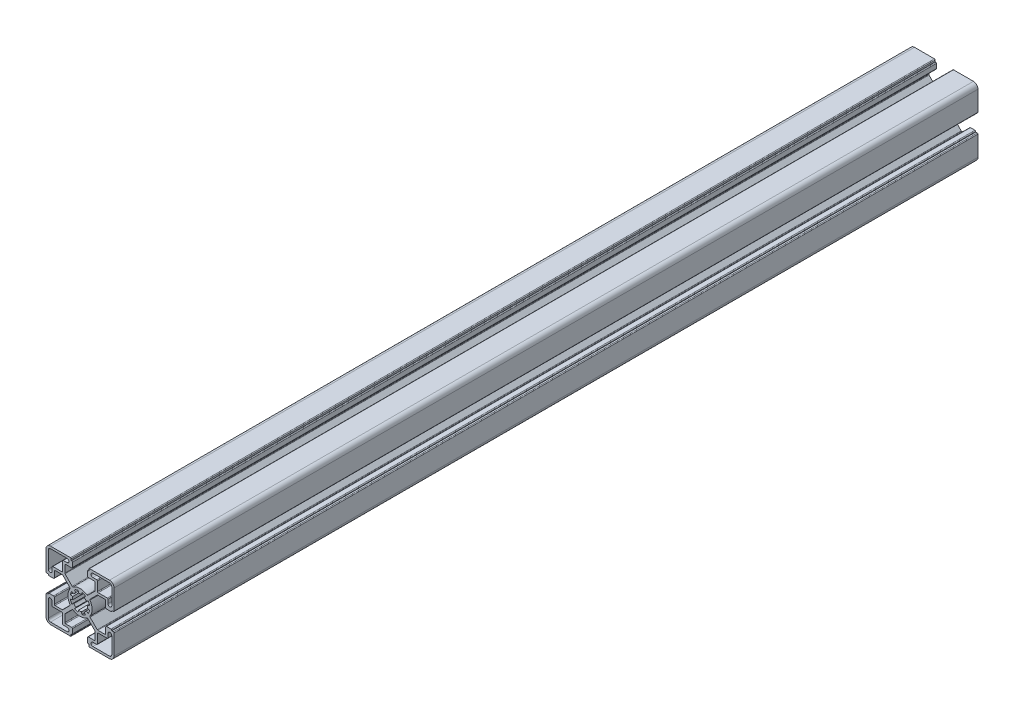
from build123d import *

# Parameters (mm, degrees)
BOSS_EXTRUDE1_DEPTH      = 152.4
BOSS_EXTRUDE1_DEPTH_BACK = 152.4
SKETCH3_R                = 5
FILLET1_R                = 0.5
CUT_EXTRUDE1_DEPTH       = 307.456424309
BOSS_EXTRUDE2_DEPTH      = 266.775


with BuildPart() as part:
    # Sketch3 → Boss-Extrude1 (new, two sides: drawn at the far end of the back side and taken through both)
    with BuildSketch(Plane.XY.offset(-BOSS_EXTRUDE1_DEPTH_BACK)):
        with BuildLine():
            Line((-11.55, -10.05), (-6.356915373, -4.856915373))
            ThreePointArc((-6.356915373, -4.856915373), (-8, 0), (-6.356915373, 4.856915373))
            Line((-6.356915373, 4.856915373), (-11.55, 10.05))
            Line((-11.55, 10.05), (-17.025, 10.05))
            Line((-17.025, 10.05), (-17.025, 5))
            Line((-17.025, 5), (-21, 5))
            Line((-21, 5), (-21, 5.8))
            Line((-21, 5.8), (-22.5, 5.8))
            Line((-22.5, 5.8), (-22.5, 19.5))
            ThreePointArc((-22.5, 19.5), (-21.621320344, 21.621320344), (-19.5, 22.5))
            Line((-19.5, 22.5), (-5.8, 22.5))
            Line((-5.8, 22.5), (-5.8, 21))
            Line((-5.8, 21), (-5, 21))
            Line((-5, 21), (-5, 17.025))
            Line((-5, 17.025), (-10.05, 17.025))
            Line((-10.05, 17.025), (-10.05, 11.55))
            Line((-10.05, 11.55), (-4.856915373, 6.356915373))
            ThreePointArc((-4.856915373, 6.356915373), (0, 8), (4.856915373, 6.356915373))
            Line((4.856915373, 6.356915373), (10.05, 11.55))
            Line((10.05, 11.55), (10.05, 17.025))
            Line((10.05, 17.025), (5, 17.025))
            Line((5, 17.025), (5, 21))
            Line((5, 21), (5.8, 21))
            Line((5.8, 21), (5.8, 22.5))
            Line((5.8, 22.5), (19.5, 22.5))
            ThreePointArc((19.5, 22.5), (21.621320344, 21.621320344), (22.5, 19.5))
            Line((22.5, 19.5), (22.5, 5.8))
            Line((22.5, 5.8), (21, 5.8))
            Line((21, 5.8), (21, 5))
            Line((21, 5), (17.025, 5))
            Line((17.025, 5), (17.025, 10.05))
            Line((17.025, 10.05), (11.55, 10.05))
            Line((11.55, 10.05), (6.356915373, 4.856915373))
            ThreePointArc((6.356915373, 4.856915373), (8, 0), (6.356915373, -4.856915373))
            Line((6.356915373, -4.856915373), (11.55, -10.05))
            Line((11.55, -10.05), (17.025, -10.05))
            Line((17.025, -10.05), (17.025, -5))
            Line((17.025, -5), (21, -5))
            Line((21, -5), (21, -5.8))
            Line((21, -5.8), (22.5, -5.8))
            Line((22.5, -5.8), (22.5, -19.5))
            ThreePointArc((22.5, -19.5), (21.621320344, -21.621320344), (19.5, -22.5))
            Line((19.5, -22.5), (5.8, -22.5))
            Line((5.8, -22.5), (5.8, -21))
            Line((5.8, -21), (5, -21))
            Line((5, -21), (5, -17.025))
            Line((5, -17.025), (10.05, -17.025))
            Line((10.05, -17.025), (10.05, -11.55))
            Line((10.05, -11.55), (4.856915373, -6.356915373))
            ThreePointArc((4.856915373, -6.356915373), (0, -8), (-4.856915373, -6.356915373))
            Line((-4.856915373, -6.356915373), (-10.05, -11.55))
            Line((-10.05, -11.55), (-10.05, -17.025))
            Line((-10.05, -17.025), (-5, -17.025))
            Line((-5, -17.025), (-5, -21))
            Line((-5, -21), (-5.8, -21))
            Line((-5.8, -21), (-5.8, -22.5))
            Line((-5.8, -22.5), (-19.5, -22.5))
            ThreePointArc((-19.5, -22.5), (-21.621320344, -21.621320344), (-22.5, -19.5))
            Line((-22.5, -19.5), (-22.5, -5.8))
            Line((-22.5, -5.8), (-21, -5.8))
            Line((-21, -5.8), (-21, -5))
            Line((-21, -5), (-17.025, -5))
            Line((-17.025, -5), (-17.025, -10.05))
            Line((-17.025, -10.05), (-11.55, -10.05))
        make_face()
        with Locations(Location((0, 0, 0), (0, 0, 180))):
            Circle(SKETCH3_R, mode=Mode.SUBTRACT)
        with BuildLine():
            Line((-21, 8.5375), (-21, 19.5))
            ThreePointArc((-21, 19.5), (-20.560660172, 20.560660172), (-19.5, 21))
            Line((-19.5, 21), (-8.5375, 21))
            ThreePointArc((-8.5375, 21), (-7.3, 19.7625), (-8.5375, 18.525))
            Line((-8.5375, 18.525), (-11.55, 18.525))
            Line((-11.55, 18.525), (-11.55, 11.55))
            Line((-11.55, 11.55), (-18.525, 11.55))
            Line((-18.525, 11.55), (-18.525, 8.5375))
            ThreePointArc((-18.525, 8.5375), (-19.7625, 7.3), (-21, 8.5375))
        make_face(mode=Mode.SUBTRACT)
        with BuildLine():
            Line((8.5375, 21), (19.5, 21))
            ThreePointArc((19.5, 21), (20.560660172, 20.560660172), (21, 19.5))
            Line((21, 19.5), (21, 8.5375))
            ThreePointArc((21, 8.5375), (19.7625, 7.3), (18.525, 8.5375))
            Line((18.525, 8.5375), (18.525, 11.55))
            Line((18.525, 11.55), (11.55, 11.55))
            Line((11.55, 11.55), (11.55, 18.525))
            Line((11.55, 18.525), (8.5375, 18.525))
            ThreePointArc((8.5375, 18.525), (7.3, 19.7625), (8.5375, 21))
        make_face(mode=Mode.SUBTRACT)
        with BuildLine():
            Line((21, -8.5375), (21, -19.5))
            ThreePointArc((21, -19.5), (20.560660172, -20.560660172), (19.5, -21))
            Line((19.5, -21), (8.5375, -21))
            ThreePointArc((8.5375, -21), (7.3, -19.7625), (8.5375, -18.525))
            Line((8.5375, -18.525), (11.55, -18.525))
            Line((11.55, -18.525), (11.55, -11.55))
            Line((11.55, -11.55), (18.525, -11.55))
            Line((18.525, -11.55), (18.525, -8.5375))
            ThreePointArc((18.525, -8.5375), (19.7625, -7.3), (21, -8.5375))
        make_face(mode=Mode.SUBTRACT)
        with BuildLine():
            Line((-8.5375, -21), (-19.5, -21))
            ThreePointArc((-19.5, -21), (-20.560660172, -20.560660172), (-21, -19.5))
            Line((-21, -19.5), (-21, -8.5375))
            ThreePointArc((-21, -8.5375), (-19.7625, -7.3), (-18.525, -8.5375))
            Line((-18.525, -8.5375), (-18.525, -11.55))
            Line((-18.525, -11.55), (-11.55, -11.55))
            Line((-11.55, -11.55), (-11.55, -18.525))
            Line((-11.55, -18.525), (-8.5375, -18.525))
            ThreePointArc((-8.5375, -18.525), (-7.3, -19.7625), (-8.5375, -21))
        make_face(mode=Mode.SUBTRACT)
    extrude(amount=BOSS_EXTRUDE1_DEPTH + BOSS_EXTRUDE1_DEPTH_BACK)

    # Fillet1
    fillet1_edges = [part.edges().sort_by_distance(p)[0] for p in [
        (-11.55, -18.525, 0),
        (-11.55, -11.55, 0),
        (18.525, -11.55, 0),
        (11.55, -11.55, 0),
        (11.55, -18.525, 0),
        (11.55, 18.525, 0),
        (11.55, 11.55, 0),
        (18.525, 11.55, 0),
        (-18.525, 11.55, 0),
        (-11.55, 11.55, 0),
        (-11.55, 18.525, 0),
        (6.356915373, -4.856915373, 0),
        (11.55, -10.05, 0),
        (17.025, -10.05, 0),
        (17.025, -5, 0),
        (21, -5, 0),
        (22.5, -5.8, 0),
        (5.8, -22.5, 0),
        (5, -21, 0),
        (5, -17.025, 0),
        (10.05, -17.025, 0),
        (10.05, -11.55, 0),
        (4.856915373, -6.356915373, 0),
        (-4.856915373, -6.356915373, 0),
        (-10.05, -11.55, 0),
        (-10.05, -17.025, 0),
        (-5, -17.025, 0),
        (-5, -21, 0),
        (-5.8, -22.5, 0),
        (-22.5, -5.8, 0),
        (-21, -5, 0),
        (-17.025, -5, 0),
        (-17.025, -10.05, 0),
        (-11.55, -10.05, 0),
        (-6.356915373, -4.856915373, 0),
        (-6.356915373, 4.856915373, 0),
        (-11.55, 10.05, 0),
        (-17.025, 10.05, 0),
        (-17.025, 5, 0),
        (-21, 5, 0),
        (-22.5, 5.8, 0),
        (-5.8, 22.5, 0),
        (-5, 21, 0),
        (-5, 17.025, 0),
        (-10.05, 17.025, 0),
        (-10.05, 11.55, 0),
        (-4.856915373, 6.356915373, 0),
        (4.856915373, 6.356915373, 0),
        (10.05, 11.55, 0),
        (10.05, 17.025, 0),
        (5, 17.025, 0),
        (5, 21, 0),
        (5.8, 22.5, 0),
        (22.5, 5.8, 0),
        (21, 5, 0),
        (17.025, 5, 0),
        (11.55, 10.05, 0),
        (6.356915373, 4.856915373, 0),
    ]]
    fillet(fillet1_edges, radius=FILLET1_R)

    # Sketch4 → Cut-Extrude1 (cut, through all)
    with BuildSketch(Plane.XY.offset(152.4)):
        with BuildLine():
            Line((-1.268087093, 6.375104323), (-0.97545161, 4.903926402))
            ThreePointArc((-0.97545161, 4.903926402), (-1.913417162, 4.619397663), (-2.777851165, 4.157348062))
            Line((-2.777851165, 4.157348062), (-3.611206515, 5.40455248))
            ThreePointArc((-3.611206515, 5.40455248), (-2.48744231, 6.005216961), (-1.268087093, 6.375104323))
        make_face()
        with BuildLine():
            Line((1.268087093, 6.375104323), (0.97545161, 4.903926402))
            ThreePointArc((0.97545161, 4.903926402), (1.913417162, 4.619397663), (2.777851165, 4.157348062))
            Line((2.777851165, 4.157348062), (3.611206515, 5.40455248))
            ThreePointArc((3.611206515, 5.40455248), (2.48744231, 6.005216961), (1.268087093, 6.375104323))
        make_face()
        with BuildLine():
            Line((5.40455248, 3.611206515), (4.157348062, 2.777851165))
            ThreePointArc((4.157348062, 2.777851165), (4.619397663, 1.913417162), (4.903926402, 0.97545161))
            Line((4.903926402, 0.97545161), (6.375104323, 1.268087093))
            ThreePointArc((6.375104323, 1.268087093), (6.005216961, 2.48744231), (5.40455248, 3.611206515))
        make_face()
        with BuildLine():
            Line((6.375104323, -1.268087093), (4.903926402, -0.97545161))
            ThreePointArc((4.903926402, -0.97545161), (4.619397663, -1.913417162), (4.157348062, -2.777851165))
            Line((4.157348062, -2.777851165), (5.40455248, -3.611206515))
            ThreePointArc((5.40455248, -3.611206515), (6.005216961, -2.48744231), (6.375104323, -1.268087093))
        make_face()
        with BuildLine():
            Line((3.611206515, -5.40455248), (2.777851165, -4.157348062))
            ThreePointArc((2.777851165, -4.157348062), (1.913417162, -4.619397663), (0.97545161, -4.903926402))
            Line((0.97545161, -4.903926402), (1.268087093, -6.375104323))
            ThreePointArc((1.268087093, -6.375104323), (2.48744231, -6.005216961), (3.611206515, -5.40455248))
        make_face()
        with BuildLine():
            Line((-1.268087093, -6.375104323), (-0.97545161, -4.903926402))
            ThreePointArc((-0.97545161, -4.903926402), (-1.913417162, -4.619397663), (-2.777851165, -4.157348062))
            Line((-2.777851165, -4.157348062), (-3.611206515, -5.40455248))
            ThreePointArc((-3.611206515, -5.40455248), (-2.48744231, -6.005216961), (-1.268087093, -6.375104323))
        make_face()
        with BuildLine():
            Line((-5.40455248, -3.611206515), (-4.157348062, -2.777851165))
            ThreePointArc((-4.157348062, -2.777851165), (-4.619397663, -1.913417162), (-4.903926402, -0.97545161))
            Line((-4.903926402, -0.97545161), (-6.375104323, -1.268087093))
            ThreePointArc((-6.375104323, -1.268087093), (-6.005216961, -2.48744231), (-5.40455248, -3.611206515))
        make_face()
        with BuildLine():
            Line((-6.375104323, 1.268087093), (-4.903926402, 0.97545161))
            ThreePointArc((-4.903926402, 0.97545161), (-4.619397663, 1.913417162), (-4.157348062, 2.777851165))
            Line((-4.157348062, 2.777851165), (-5.40455248, 3.611206515))
            ThreePointArc((-5.40455248, 3.611206515), (-6.005216961, 2.48744231), (-6.375104323, 1.268087093))
        make_face()
    extrude(amount=-CUT_EXTRUDE1_DEPTH, mode=Mode.SUBTRACT)

    # Sketch5 → Boss-Extrude2 (add)
    with BuildSketch(Plane.XY.offset(152.4)):
        with BuildLine():
            Line((22.5, -19.5), (22.5, -6.3))
            ThreePointArc((22.5, -6.3), (22.353553391, -5.946446609), (22, -5.8))
            Line((22, -5.8), (21, -5.8))
            Line((21, -5.8), (21, -5.5))
            ThreePointArc((21, -5.5), (20.853553391, -5.146446609), (20.5, -5))
            Line((20.5, -5), (17.525, -5))
            ThreePointArc((17.525, -5), (17.171446609, -5.146446609), (17.025, -5.5))
            Line((17.025, -5.5), (17.025, -9.55))
            ThreePointArc((17.025, -9.55), (16.878553391, -9.903553391), (16.525, -10.05))
            Line((16.525, -10.05), (11.757106781, -10.05))
            ThreePointArc((11.757106781, -10.05), (11.565765065, -10.011939766), (11.403553391, -9.903553391))
            Line((11.403553391, -9.903553391), (6.658229, -5.158229))
            ThreePointArc((6.658229, -5.158229), (6.513911961, -4.850773717), (6.599324603, -4.522047632))
            ThreePointArc((6.599324603, -4.522047632), (8, 0), (6.599324603, 4.522047632))
            ThreePointArc((6.599324603, 4.522047632), (6.513911961, 4.850773717), (6.658229, 5.158229))
            Line((6.658229, 5.158229), (11.403553391, 9.903553391))
            ThreePointArc((11.403553391, 9.903553391), (11.565765065, 10.011939766), (11.757106781, 10.05))
            Line((11.757106781, 10.05), (17.025, 10.05))
            Line((17.025, 10.05), (17.025, 5.5))
            ThreePointArc((17.025, 5.5), (17.171446609, 5.146446609), (17.525, 5))
            Line((17.525, 5), (20.5, 5))
            ThreePointArc((20.5, 5), (20.853553391, 5.146446609), (21, 5.5))
            Line((21, 5.5), (21, 5.8))
            Line((21, 5.8), (22, 5.8))
            ThreePointArc((22, 5.8), (22.353553391, 5.946446609), (22.5, 6.3))
            Line((22.5, 6.3), (22.5, 19.5))
            ThreePointArc((22.5, 19.5), (21.621320344, 21.621320344), (19.5, 22.5))
            Line((19.5, 22.5), (6.3, 22.5))
            ThreePointArc((6.3, 22.5), (5.946446609, 22.353553391), (5.8, 22))
            Line((5.8, 22), (5.8, 21))
            Line((5.8, 21), (5.5, 21))
            ThreePointArc((5.5, 21), (5.146446609, 20.853553391), (5, 20.5))
            Line((5, 20.5), (5, 17.525))
            ThreePointArc((5, 17.525), (5.146446609, 17.171446609), (5.5, 17.025))
            Line((5.5, 17.025), (9.55, 17.025))
            ThreePointArc((9.55, 17.025), (9.903553391, 16.878553391), (10.05, 16.525))
            Line((10.05, 16.525), (10.05, 11.757106781))
            ThreePointArc((10.05, 11.757106781), (10.011939766, 11.565765065), (9.903553391, 11.403553391))
            Line((9.903553391, 11.403553391), (5.158229, 6.658229))
            ThreePointArc((5.158229, 6.658229), (4.850773717, 6.513911961), (4.522047632, 6.599324603))
            ThreePointArc((4.522047632, 6.599324603), (0, 8), (-4.522047632, 6.599324603))
            ThreePointArc((-4.522047632, 6.599324603), (-4.850773717, 6.513911961), (-5.158229, 6.658229))
            Line((-5.158229, 6.658229), (-9.903553391, 11.403553391))
            ThreePointArc((-9.903553391, 11.403553391), (-10.011939766, 11.565765065), (-10.05, 11.757106781))
            Line((-10.05, 11.757106781), (-10.05, 16.525))
            ThreePointArc((-10.05, 16.525), (-9.903553391, 16.878553391), (-9.55, 17.025))
            Line((-9.55, 17.025), (-5.5, 17.025))
            ThreePointArc((-5.5, 17.025), (-5.146446609, 17.171446609), (-5, 17.525))
            Line((-5, 17.525), (-5, 20.5))
            ThreePointArc((-5, 20.5), (-5.146446609, 20.853553391), (-5.5, 21))
            Line((-5.5, 21), (-5.8, 21))
            Line((-5.8, 21), (-5.8, 22))
            ThreePointArc((-5.8, 22), (-5.946446609, 22.353553391), (-6.3, 22.5))
            Line((-6.3, 22.5), (-19.5, 22.5))
            ThreePointArc((-19.5, 22.5), (-21.621320344, 21.621320344), (-22.5, 19.5))
            Line((-22.5, 19.5), (-22.5, 6.3))
            ThreePointArc((-22.5, 6.3), (-22.353553391, 5.946446609), (-22, 5.8))
            Line((-22, 5.8), (-21, 5.8))
            Line((-21, 5.8), (-21, 5.5))
            ThreePointArc((-21, 5.5), (-20.853553391, 5.146446609), (-20.5, 5))
            Line((-20.5, 5), (-17.525, 5))
            ThreePointArc((-17.525, 5), (-17.171446609, 5.146446609), (-17.025, 5.5))
            Line((-17.025, 5.5), (-17.025, 9.55))
            ThreePointArc((-17.025, 9.55), (-16.878553391, 9.903553391), (-16.525, 10.05))
            Line((-16.525, 10.05), (-11.757106781, 10.05))
            ThreePointArc((-11.757106781, 10.05), (-11.565765065, 10.011939766), (-11.403553391, 9.903553391))
            Line((-11.403553391, 9.903553391), (-6.658229, 5.158229))
            ThreePointArc((-6.658229, 5.158229), (-6.513911961, 4.850773717), (-6.599324603, 4.522047632))
            ThreePointArc((-6.599324603, 4.522047632), (-8, 0), (-6.599324603, -4.522047632))
            ThreePointArc((-6.599324603, -4.522047632), (-6.513911961, -4.850773717), (-6.658229, -5.158229))
            Line((-6.658229, -5.158229), (-11.403553391, -9.903553391))
            ThreePointArc((-11.403553391, -9.903553391), (-11.565765065, -10.011939766), (-11.757106781, -10.05))
            Line((-11.757106781, -10.05), (-16.525, -10.05))
            ThreePointArc((-16.525, -10.05), (-16.878553391, -9.903553391), (-17.025, -9.55))
            Line((-17.025, -9.55), (-17.025, -5.5))
            ThreePointArc((-17.025, -5.5), (-17.171446609, -5.146446609), (-17.525, -5))
            Line((-17.525, -5), (-20.5, -5))
            ThreePointArc((-20.5, -5), (-20.853553391, -5.146446609), (-21, -5.5))
            Line((-21, -5.5), (-21, -5.8))
            Line((-21, -5.8), (-22, -5.8))
            ThreePointArc((-22, -5.8), (-22.353553391, -5.946446609), (-22.5, -6.3))
            Line((-22.5, -6.3), (-22.5, -19.5))
            ThreePointArc((-22.5, -19.5), (-21.621320344, -21.621320344), (-19.5, -22.5))
            Line((-19.5, -22.5), (-6.3, -22.5))
            ThreePointArc((-6.3, -22.5), (-5.946446609, -22.353553391), (-5.8, -22))
            Line((-5.8, -22), (-5.8, -21))
            Line((-5.8, -21), (-5.5, -21))
            ThreePointArc((-5.5, -21), (-5.146446609, -20.853553391), (-5, -20.5))
            Line((-5, -20.5), (-5, -17.525))
            ThreePointArc((-5, -17.525), (-5.146446609, -17.171446609), (-5.5, -17.025))
            Line((-5.5, -17.025), (-9.55, -17.025))
            ThreePointArc((-9.55, -17.025), (-9.903553391, -16.878553391), (-10.05, -16.525))
            Line((-10.05, -16.525), (-10.05, -11.757106781))
            ThreePointArc((-10.05, -11.757106781), (-10.011939766, -11.565765065), (-9.903553391, -11.403553391))
            Line((-9.903553391, -11.403553391), (-5.158229, -6.658229))
            ThreePointArc((-5.158229, -6.658229), (-4.850773717, -6.513911961), (-4.522047632, -6.599324603))
            ThreePointArc((-4.522047632, -6.599324603), (0, -8), (4.522047632, -6.599324603))
            ThreePointArc((4.522047632, -6.599324603), (4.850773717, -6.513911961), (5.158229, -6.658229))
            Line((5.158229, -6.658229), (9.903553391, -11.403553391))
            ThreePointArc((9.903553391, -11.403553391), (10.011939766, -11.565765065), (10.05, -11.757106781))
            Line((10.05, -11.757106781), (10.05, -16.525))
            ThreePointArc((10.05, -16.525), (9.903553391, -16.878553391), (9.55, -17.025))
            Line((9.55, -17.025), (5.5, -17.025))
            ThreePointArc((5.5, -17.025), (5.146446609, -17.171446609), (5, -17.525))
            Line((5, -17.525), (5, -20.5))
            ThreePointArc((5, -20.5), (5.146446609, -20.853553391), (5.5, -21))
            Line((5.5, -21), (5.8, -21))
            Line((5.8, -21), (5.8, -22))
            ThreePointArc((5.8, -22), (5.946446609, -22.353553391), (6.3, -22.5))
            Line((6.3, -22.5), (19.5, -22.5))
            ThreePointArc((19.5, -22.5), (21.621320344, -21.621320344), (22.5, -19.5))
        make_face()
        with BuildLine():
            Line((-11.55, -18.025), (-11.55, -12.05))
            ThreePointArc((-11.55, -12.05), (-11.696446609, -11.696446609), (-12.05, -11.55))
            Line((-12.05, -11.55), (-18.525, -11.55))
            Line((-18.525, -11.55), (-18.525, -8.5375))
            ThreePointArc((-18.525, -8.5375), (-19.7625, -7.3), (-21, -8.5375))
            Line((-21, -8.5375), (-21, -19.5))
            ThreePointArc((-21, -19.5), (-20.560660172, -20.560660172), (-19.5, -21))
            Line((-19.5, -21), (-8.5375, -21))
            ThreePointArc((-8.5375, -21), (-7.3, -19.7625), (-8.5375, -18.525))
            Line((-8.5375, -18.525), (-11.05, -18.525))
            ThreePointArc((-11.05, -18.525), (-11.403553391, -18.378553391), (-11.55, -18.025))
        make_face(mode=Mode.SUBTRACT)
        with BuildLine():
            Line((-0.97545161, 4.903926402), (-1.268087093, 6.375104323))
            ThreePointArc((-1.268087093, 6.375104323), (-2.48744231, 6.005216961), (-3.611206515, 5.40455248))
            Line((-3.611206515, 5.40455248), (-2.777851165, 4.157348062))
            ThreePointArc((-2.777851165, 4.157348062), (-3.535533906, 3.535533906), (-4.157348062, 2.777851165))
            Line((-4.157348062, 2.777851165), (-5.40455248, 3.611206515))
            ThreePointArc((-5.40455248, 3.611206515), (-6.005216961, 2.48744231), (-6.375104323, 1.268087093))
            Line((-6.375104323, 1.268087093), (-4.903926402, 0.97545161))
            ThreePointArc((-4.903926402, 0.97545161), (-5, 0), (-4.903926402, -0.97545161))
            Line((-4.903926402, -0.97545161), (-6.375104323, -1.268087093))
            ThreePointArc((-6.375104323, -1.268087093), (-6.005216961, -2.48744231), (-5.40455248, -3.611206515))
            Line((-5.40455248, -3.611206515), (-4.157348062, -2.777851165))
            ThreePointArc((-4.157348062, -2.777851165), (-3.535533906, -3.535533906), (-2.777851165, -4.157348062))
            Line((-2.777851165, -4.157348062), (-3.611206515, -5.40455248))
            ThreePointArc((-3.611206515, -5.40455248), (-2.48744231, -6.005216961), (-1.268087093, -6.375104323))
            Line((-1.268087093, -6.375104323), (-0.97545161, -4.903926402))
            ThreePointArc((-0.97545161, -4.903926402), (0, -5), (0.97545161, -4.903926402))
            Line((0.97545161, -4.903926402), (1.268087093, -6.375104323))
            ThreePointArc((1.268087093, -6.375104323), (2.48744231, -6.005216961), (3.611206515, -5.40455248))
            Line((3.611206515, -5.40455248), (2.777851165, -4.157348062))
            ThreePointArc((2.777851165, -4.157348062), (3.535533906, -3.535533906), (4.157348062, -2.777851165))
            Line((4.157348062, -2.777851165), (5.40455248, -3.611206515))
            ThreePointArc((5.40455248, -3.611206515), (6.005216961, -2.48744231), (6.375104323, -1.268087093))
            Line((6.375104323, -1.268087093), (4.903926402, -0.97545161))
            ThreePointArc((4.903926402, -0.97545161), (5, 0), (4.903926402, 0.97545161))
            Line((4.903926402, 0.97545161), (6.375104323, 1.268087093))
            ThreePointArc((6.375104323, 1.268087093), (6.005216961, 2.48744231), (5.40455248, 3.611206515))
            Line((5.40455248, 3.611206515), (4.157348062, 2.777851165))
            ThreePointArc((4.157348062, 2.777851165), (3.535533906, 3.535533906), (2.777851165, 4.157348062))
            Line((2.777851165, 4.157348062), (3.611206515, 5.40455248))
            ThreePointArc((3.611206515, 5.40455248), (2.48744231, 6.005216961), (1.268087093, 6.375104323))
            Line((1.268087093, 6.375104323), (0.97545161, 4.903926402))
            ThreePointArc((0.97545161, 4.903926402), (0, 5), (-0.97545161, 4.903926402))
        make_face(mode=Mode.SUBTRACT)
        with BuildLine():
            Line((18.025, -11.55), (12.05, -11.55))
            ThreePointArc((12.05, -11.55), (11.696446609, -11.696446609), (11.55, -12.05))
            Line((11.55, -12.05), (11.55, -18.025))
            ThreePointArc((11.55, -18.025), (11.403553391, -18.378553391), (11.05, -18.525))
            Line((11.05, -18.525), (8.5375, -18.525))
            ThreePointArc((8.5375, -18.525), (7.3, -19.7625), (8.5375, -21))
            Line((8.5375, -21), (19.5, -21))
            ThreePointArc((19.5, -21), (20.560660172, -20.560660172), (21, -19.5))
            Line((21, -19.5), (21, -8.5375))
            ThreePointArc((21, -8.5375), (19.7625, -7.3), (18.525, -8.5375))
            Line((18.525, -8.5375), (18.525, -11.05))
            ThreePointArc((18.525, -11.05), (18.378553391, -11.403553391), (18.025, -11.55))
        make_face(mode=Mode.SUBTRACT)
        with BuildLine():
            Line((11.55, 18.025), (11.55, 12.05))
            ThreePointArc((11.55, 12.05), (11.696446609, 11.696446609), (12.05, 11.55))
            Line((12.05, 11.55), (18.025, 11.55))
            ThreePointArc((18.025, 11.55), (18.378553391, 11.403553391), (18.525, 11.05))
            Line((18.525, 11.05), (18.525, 8.5375))
            ThreePointArc((18.525, 8.5375), (19.7625, 7.3), (21, 8.5375))
            Line((21, 8.5375), (21, 19.5))
            ThreePointArc((21, 19.5), (20.560660172, 20.560660172), (19.5, 21))
            Line((19.5, 21), (8.5375, 21))
            ThreePointArc((8.5375, 21), (7.3, 19.7625), (8.5375, 18.525))
            Line((8.5375, 18.525), (11.05, 18.525))
            ThreePointArc((11.05, 18.525), (11.403553391, 18.378553391), (11.55, 18.025))
        make_face(mode=Mode.SUBTRACT)
        with BuildLine():
            Line((-18.025, 11.55), (-12.05, 11.55))
            ThreePointArc((-12.05, 11.55), (-11.696446609, 11.696446609), (-11.55, 12.05))
            Line((-11.55, 12.05), (-11.55, 18.025))
            ThreePointArc((-11.55, 18.025), (-11.403553391, 18.378553391), (-11.05, 18.525))
            Line((-11.05, 18.525), (-8.5375, 18.525))
            ThreePointArc((-8.5375, 18.525), (-7.3, 19.7625), (-8.5375, 21))
            Line((-8.5375, 21), (-19.5, 21))
            ThreePointArc((-19.5, 21), (-20.560660172, 20.560660172), (-21, 19.5))
            Line((-21, 19.5), (-21, 8.5375))
            ThreePointArc((-21, 8.5375), (-19.7625, 7.3), (-18.525, 8.5375))
            Line((-18.525, 8.5375), (-18.525, 11.05))
            ThreePointArc((-18.525, 11.05), (-18.378553391, 11.403553391), (-18.025, 11.55))
        make_face(mode=Mode.SUBTRACT)
    extrude(amount=BOSS_EXTRUDE2_DEPTH)


solid = part.part
